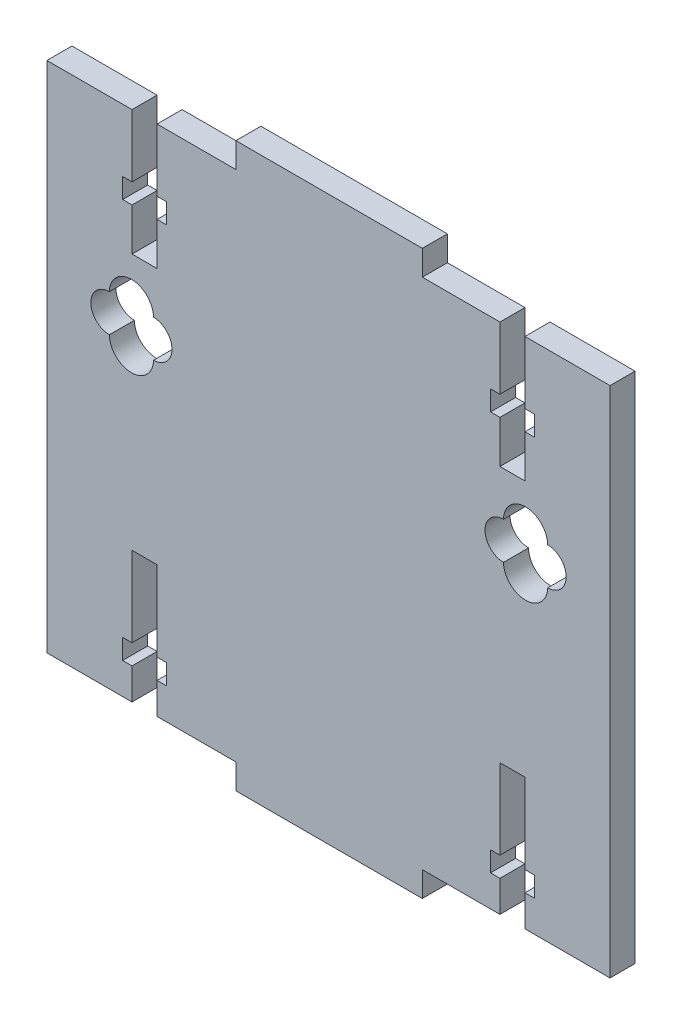
from build123d import *

# Parameters (mm, degrees)
SKETCH1_W           = 90
SKETCH1_H           = 82
BOSS_EXTRUDE1_DEPTH = 4
SKETCH4_W           = 29.8
SKETCH4_H           = 4
BOSS_EXTRUDE2_DEPTH = 4
CUT_EXTRUDE1_DEPTH  = 10
CUT_EXTRUDE2_DEPTH  = 10


with BuildPart() as part:
    # Sketch1 → Boss-Extrude1 (new body)
    with BuildSketch(Plane.XY):
        Rectangle(SKETCH1_W, SKETCH1_H)
    extrude(amount=BOSS_EXTRUDE1_DEPTH)

    # Sketch4 → Boss-Extrude2 (add)
    with BuildSketch(Plane.XY.offset(4)):
        with Locations((0.1, 43)):
            Rectangle(SKETCH4_W, SKETCH4_H)
    boss_extrude2 = extrude(amount=-BOSS_EXTRUDE2_DEPTH)

    # Mirror1: Boss-Extrude2 across plane
    add(boss_extrude2.mirror(Plane(origin=(0, 0, 0), x_dir=(0, 0, 1), z_dir=(0, -1, 0))))

    # Sketch5 → Cut-Extrude1 (cut)
    with BuildSketch(Plane.XY.offset(4)):
        Polygon((27.39999999, 41), (27.39999999, 31), (25.89999999, 31), (25.89999999, 27.8), (27.39999999, 27.8), (27.39999999, 21), (31.39999999, 21), (31.39999999, 27.8), (32.89999999, 27.8), (32.89999999, 31), (31.39999999, 31), (31.39999999, 41), align=None)
        Polygon((-27.39999999, 27.8), (-27.39999999, 21), (-31.39999999, 21), (-31.39999999, 27.8), (-32.89999999, 27.8), (-32.89999999, 31), (-31.39999999, 31), (-31.39999999, 41), (-27.39999999, 41), (-27.39999999, 31), (-25.89999999, 31), (-25.89999999, 27.8), align=None)
        Polygon((-27.4, -36), (-27.4, -41), (-31.4, -41), (-31.4, -36), (-32.9, -36), (-32.9, -32.8), (-31.4, -32.8), (-31.4, -20), (-27.4, -20), (-27.4, -32.8), (-25.9, -32.8), (-25.9, -36), align=None)
        Polygon((31.4, -41), (31.4, -36), (32.9, -36), (32.9, -32.8), (31.4, -32.8), (31.4, -20), (27.4, -20), (27.4, -32.8), (25.9, -32.8), (25.9, -36), (27.4, -36), (27.4, -41), align=None)
    extrude(amount=-CUT_EXTRUDE1_DEPTH, mode=Mode.SUBTRACT)

    # Sketch6 → Cut-Extrude2 (cut)
    with BuildSketch(Plane.XY.offset(4)):
        with BuildLine():
            ThreePointArc((27.96981837, 8.015850853), (25.015698228, 11), (27.96981837, 13.984149147))
            ThreePointArc((27.96981837, 13.984149147), (31.5, 17.463580565), (35.03018163, 13.984149147))
            ThreePointArc((35.03018163, 13.984149147), (37.984301772, 11), (35.03018163, 8.015850853))
            ThreePointArc((35.03018163, 8.015850853), (31.5, 4.536419435), (27.96981837, 8.015850853))
        make_face()
        with BuildLine():
            ThreePointArc((-27.96981837, 13.984149147), (-31.5, 17.463580565), (-35.03018163, 13.984149147))
            ThreePointArc((-35.03018163, 13.984149147), (-37.984301772, 11), (-35.03018163, 8.015850853))
            ThreePointArc((-35.03018163, 8.015850853), (-31.5, 4.536419435), (-27.96981837, 8.015850853))
            ThreePointArc((-27.96981837, 8.015850853), (-25.015698228, 11), (-27.96981837, 13.984149147))
        make_face()
    extrude(amount=-CUT_EXTRUDE2_DEPTH, mode=Mode.SUBTRACT)


solid = part.part
